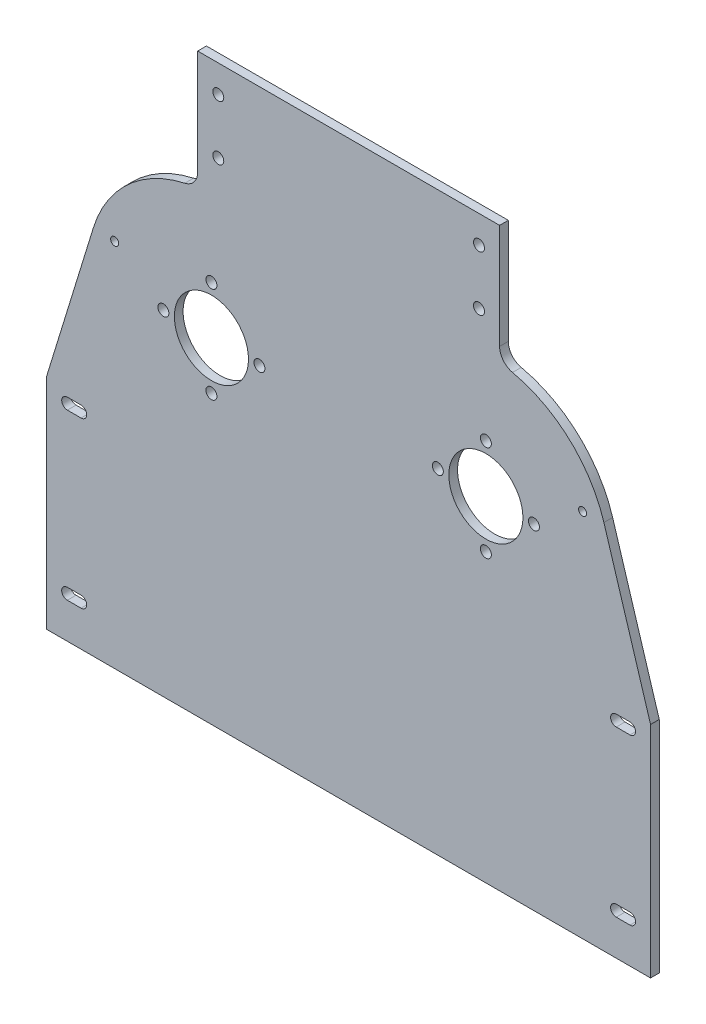
from build123d import *

# Parameters (mm, degrees)
SKETCH1_W           = 110
SKETCH1_H           = 140
SKETCH1_R           = 2
BOSS_EXTRUDE1_DEPTH = 3.175
SKETCH3_R           = 45
SKETCH3_R_2         = 2
SKETCH3_R_3         = 13.5
SKETCH3_R_4         = 1.4732
BOSS_EXTRUDE3_DEPTH = 3.175
SKETCH4_W           = 110
SKETCH4_H           = 10
BOSS_EXTRUDE5_DEPTH = 3.175
FILLET1_R           = 6
SKETCH6_R           = 2
SKETCH6_R_2         = 13.5
CUT_EXTRUDE1_DEPTH  = 10


with BuildPart() as part:
    # Sketch1 → Boss-Extrude1 (new body)
    with BuildSketch(Plane.XY):
        Rectangle(SKETCH1_W, SKETCH1_H)
        with Locations((-47.5, 40)):
            Circle(SKETCH1_R, mode=Mode.SUBTRACT)
        with Locations((47.5, 40)):
            Circle(SKETCH1_R, mode=Mode.SUBTRACT)
        with Locations((-47.5, 60)):
            Circle(SKETCH1_R, mode=Mode.SUBTRACT)
        with Locations((47.5, 60)):
            Circle(SKETCH1_R, mode=Mode.SUBTRACT)
    extrude(amount=BOSS_EXTRUDE1_DEPTH)

    # Sketch3 → Boss-Extrude3 (add)
    # profile 1 of 2: a face of its own
    with BuildSketch(Plane.XY.offset(3.175)):
        with Locations((-50, -18)):
            Circle(SKETCH3_R)
        with Locations((-67.5, -18)):
            Circle(SKETCH3_R_2, mode=Mode.SUBTRACT)
        with Locations((-50, -18)):
            Circle(SKETCH3_R_3, mode=Mode.SUBTRACT)
        with Locations((-85.238473279, -5.174244625)):
            Circle(SKETCH3_R_4, mode=Mode.SUBTRACT)
    # profile 2 of 2: a face of its own
    with BuildSketch(Plane.XY.offset(3.175)):
        with Locations((50, -18)):
            Circle(SKETCH3_R)
        with Locations((67.5, -18)):
            Circle(SKETCH3_R_2, mode=Mode.SUBTRACT)
        with Locations((50, -18)):
            Circle(SKETCH3_R_3, mode=Mode.SUBTRACT)
        with Locations((85.238473279, -5.174244625)):
            Circle(SKETCH3_R_4, mode=Mode.SUBTRACT)
    extrude(amount=-BOSS_EXTRUDE3_DEPTH)

    # Sketch4 → Boss-Extrude5 (add)
    # profile 1 of 4: a face of its own
    with BuildSketch(Plane.XY.offset(3.175)):
        with BuildLine():
            ThreePointArc((-60, -61.874821937), (-63.111300905, -61.047575873), (-66.155494421, -60))
            Line((-66.155494421, -60), (-110, -60))
            Line((-110, -60), (-110, -130))
            Line((-110, -130), (-60, -130))
            Line((-60, -130), (-60, -121.715728753))
            Line((-60, -121.715728753), (-60, -61.874821937))
        make_face()
        with BuildLine():
            Line((-102.5, -122.95), (-97.5, -122.95))
            ThreePointArc((-97.5, -122.95), (-95.45, -125), (-97.5, -127.05))
            Line((-97.5, -127.05), (-102.5, -127.05))
            ThreePointArc((-102.5, -127.05), (-104.55, -125), (-102.5, -122.95))
        make_face(mode=Mode.SUBTRACT)
        with BuildLine():
            ThreePointArc((-97.5, -62.95), (-95.45, -65), (-97.5, -67.05))
            Line((-97.5, -67.05), (-102.5, -67.05))
            ThreePointArc((-102.5, -67.05), (-104.55, -65), (-102.5, -62.95))
            Line((-102.5, -62.95), (-97.5, -62.95))
        make_face(mode=Mode.SUBTRACT)
    # profile 2 of 4: a face of its own
    with BuildSketch(Plane.XY.offset(3.175)):
        with BuildLine():
            Line((-110, -60), (-66.155494421, -60))
            ThreePointArc((-66.155494421, -60), (-90.46935182, -37.678200204), (-93.011169428, -4.76975796))
            Line((-93.011169428, -4.76975796), (-110, -60))
        make_face()
    # profile 3 of 4: a face of its own
    with BuildSketch(Plane.XY.offset(3.175)):
        with BuildLine():
            ThreePointArc((-55, -62.72135955), (-57.51193427, -62.368579462), (-60, -61.874821937))
            Line((-60, -61.874821937), (-60, -121.715728753))
            Line((-60, -121.715728753), (-60, -130))
            Line((-60, -130), (0, -130))
            Line((0, -130), (0, -70))
            Line((0, -70), (-55, -70))
            Line((-55, -70), (-55, -62.72135955))
        make_face()
    # profile 4 of 4: a face of its own
    with BuildSketch(Plane.XY.offset(3.175)):
        with Locations((-55, -135)):
            Rectangle(SKETCH4_W, SKETCH4_H)
    boss_extrude5 = extrude(amount=-BOSS_EXTRUDE5_DEPTH)

    # Mirror2: Boss-Extrude5 across plane
    add(boss_extrude5.mirror(Plane(origin=(0, 0, 0), x_dir=(0, 0, 1), z_dir=(1, 0, 0))))

    # Fillet1
    fillet1_edges = [part.edges().sort_by_distance(p)[0] for p in [
        (-55, 26.72135955, 1.5875),
        (55, 26.72135955, 1.5875),
    ]]
    fillet(fillet1_edges, radius=FILLET1_R)

    # Sketch6 → Cut-Extrude1 (cut)
    with BuildSketch(Plane.XY.offset(3.175)):
        with Locations((32.5, -18)):
            Circle(SKETCH6_R)
        with Locations((50, -0.5)):
            Circle(SKETCH6_R)
        with Locations((67.5, -18)):
            Circle(SKETCH6_R)
        with Locations((50, -18)):
            Circle(SKETCH6_R_2)
        with Locations((50, -35.5)):
            Circle(SKETCH6_R)
        with Locations((-50, -18)):
            Circle(SKETCH6_R_2)
        with Locations((-67.5, -18)):
            Circle(SKETCH6_R)
        with Locations((-50, -35.5)):
            Circle(SKETCH6_R)
        with Locations((-32.5, -18)):
            Circle(SKETCH6_R)
        with Locations((-50, -0.5)):
            Circle(SKETCH6_R)
    extrude(amount=-CUT_EXTRUDE1_DEPTH, mode=Mode.SUBTRACT)


solid = part.part
